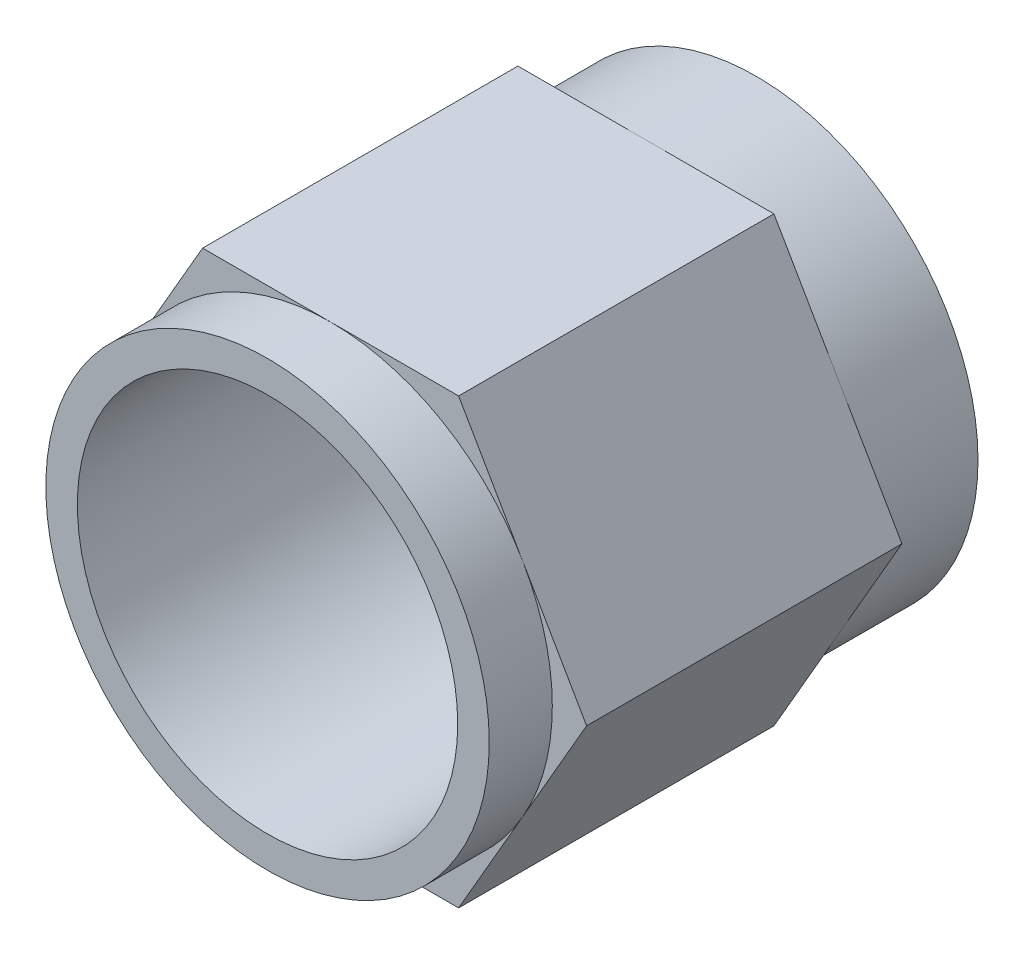
from build123d import *

# Parameters (mm, degrees)
SKETCH1_W           = 1.016
SKETCH1_H           = 14.732
SKETCH1_W_2         = 7.14375
SKETCH1_H_2         = 1.016
SKETCH1_W_3         = 3.945946328
SKETCH1_H_3         = 0.762
SKETCH2_R           = 6.12775
BOSS_EXTRUDE1_DEPTH = 10.16


with BuildPart() as part:
    # Sketch1 → Revolve1 (revolve)
    with BuildSketch(Plane(origin=(0, 0, 0), x_dir=(1, 0, 0), z_dir=(0, 1, 0))):
        with Locations((6.63575, 5.334)):
            Rectangle(SKETCH1_W, SKETCH1_H)
        with Locations((3.571875, 13.208)):
            Rectangle(SKETCH1_W_2, SKETCH1_H_2)
        with Locations((1.972973164, 14.097)):
            Rectangle(SKETCH1_W_3, SKETCH1_H_3)
    revolve(axis=Axis((0, 0, 288.756429932), (0, 0, -1)))

    # Sketch2 → Boss-Extrude1 (add)
    with BuildSketch(Plane.XY):
        Polygon((8.248891971, 0), (4.124445986, 7.14375), (-4.124445986, 7.14375), (-8.248891971, 0), (-4.124445986, -7.14375), (4.124445986, -7.14375), align=None)
        Circle(SKETCH2_R, mode=Mode.SUBTRACT)
    extrude(amount=-BOSS_EXTRUDE1_DEPTH)


solid = part.part
